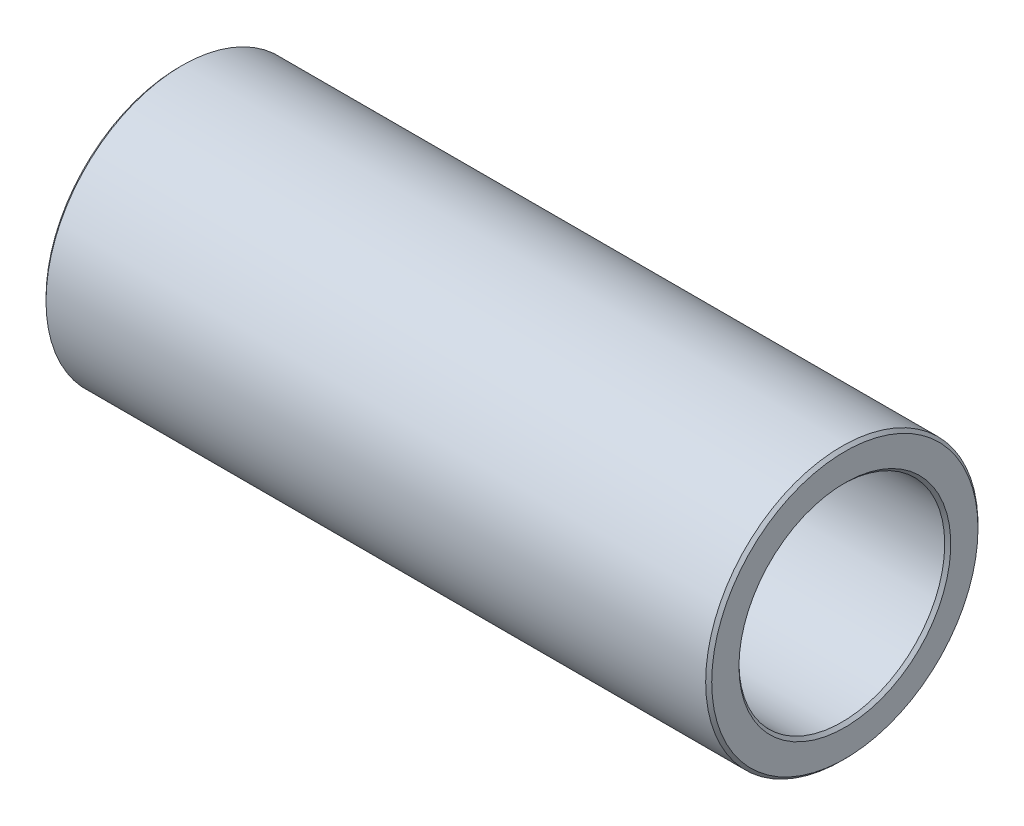
from build123d import *

# Parameters (mm, degrees)
CHAMFER1_SIZE = 0.5


with BuildPart() as part:
    # Sketch1 → Revolve1 (revolve)
    with BuildSketch(Plane.XY, mode=Mode.PRIVATE) as revolve1_sk:
        Polygon((0, 22.5), (110, 22.5), (110, 17), (64, 17), (64, 12), (4, 12), (4, 9), (0, 9), align=None)
    revolve(revolve1_sk.sketch.rotate(Axis((0, 0, 0), (1, 0, 0)), 90), axis=Axis((0, 0, 0), (1, 0, 0)))

    # Chamfer1
    chamfer1_edges = [part.edges().sort_by_distance(p)[0] for p in [
        (0, 0, -22.5),
        (0, 0, -9),
        (64, 0, -17),
        (110, 0, -17),
        (110, 0, -22.5),
    ]]
    chamfer(chamfer1_edges, length=CHAMFER1_SIZE)


solid = part.part
